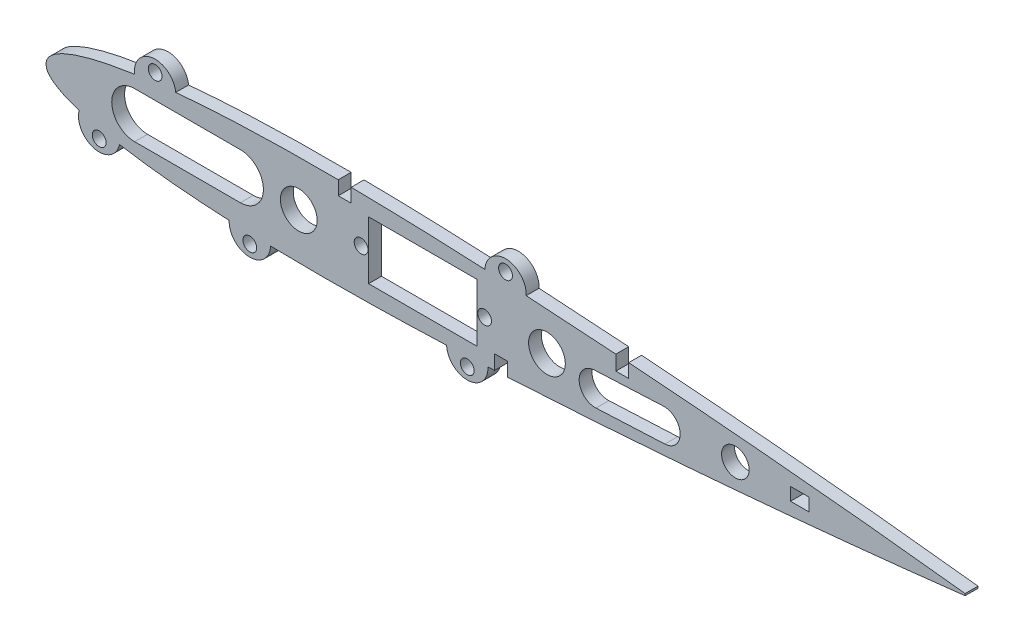
from build123d import *

# Parameters (mm, degrees)
SKETCH_3_R      = 4
SKETCH_3_R_2    = 3
SKETCH_3_R_3    = 1.5
SKETCH_3_R_4    = 1.500000004
SKETCH_3_R_5    = 1.499999999
SKETCH_3_W      = 23.6
SKETCH_3_H      = 12.6
SKETCH_3_W_2    = 4
SKETCH_3_H_2    = 2.8
EXTRUDE_3_DEPTH = 2.8


with BuildPart() as part:
    # Эскиз3 → Бобышка-Вытянуть3 (new body)
    with BuildSketch(Plane.XY):
        with BuildLine():
            Line((200, 0.21), (200, -0.21))
            add(Edge.make_bspline(
                [(173.839461144, -3.040801203), (175.943333039, -2.830170954), (179.564023078, -2.461029339), (184.58704572, -1.932479181), (188.771568451, -1.480695182), (192.530784687, -1.065063842), (195.747560944, -0.701689979), (198.179524953, -0.422303954), (199.520051416, -0.265971644), (200, -0.21)],
                knots=[0.870307302, 0.870307302, 0.870307302, 0.870307302, 0.901571134, 0.924121062, 0.944988816, 0.963803939, 0.980044339, 0.992855276, 1, 1, 1, 1], degree=3))
            Line((173.839461144, -3.040801203), (162.170244806, -4.170244806))
            add(Edge.make_bspline(
                [(100.4, -8.802264), (100.782530515, -8.78200637), (103.102887785, -8.657921344), (107.374551667, -8.416266925), (113.223109349, -8.057497647), (119.097620698, -7.671146294), (124.98256269, -7.259840679), (130.861479372, -6.826169971), (136.716836604, -6.372892076), (142.52985565, -5.902766003), (148.280267017, -5.418602057), (153.94609331, -4.923426646), (158.566687276, -4.50520567), (161.295968592, -4.251994411), (162.170244806, -4.170244806)],
                knots=[0.507199784, 0.507199784, 0.507199784, 0.507199784, 0.512863887, 0.541558094, 0.570462313, 0.599504248, 0.628607349, 0.657690446, 0.686667237, 0.715444849, 0.743923546, 0.77199483, 0.799540253, 0.812523886, 0.812523886, 0.812523886, 0.812523886], degree=3))
            Line((100.4, -8.802264), (100.4, -5.802264))
            Line((100.4, -5.802264), (97.6, -5.802264))
            Line((97.6, -5.802264), (97.6, -8.946938935))
            add(Edge.make_bspline(
                [(96.16294038, -9.018329177), (96.641976589, -8.994862294), (97.120996479, -8.971063118), (97.6, -8.946938935)],
                knots=[0.486289284, 0.486289284, 0.486289284, 0.486289284, 0.493380908, 0.493380908, 0.493380908, 0.493380908], degree=3))
            ThreePointArc((96.16294038, -9.018329177), (91.867526446, -13.724080291), (87.17182932, -9.417677743))
            add(Edge.make_bspline(
                [(48.849842288, -9.876307099), (50.29548458, -9.910701869), (53.368870018, -9.967597185), (58.119580476, -10.007674079), (63.1472323, -10.001179647), (68.312112853, -9.948180779), (73.603706203, -9.849984193), (79.011121779, -9.708185508), (83.546665754, -9.557168434), (86.278412172, -9.453068368), (87.17182932, -9.417677743)],
                knots=[0.253007448, 0.253007448, 0.253007448, 0.253007448, 0.274388983, 0.298458209, 0.323253842, 0.348727971, 0.374830387, 0.40150919, 0.428710016, 0.441930624, 0.441930624, 0.441930624, 0.441930624], degree=3))
            ThreePointArc((48.849842288, -9.876307099), (44.191437181, -14.24080929), (39.855729482, -9.55559251))
            add(Edge.make_bspline(
                [(15.984525285, -7.176038428), (16.462030484, -7.259158951), (17.98454817, -7.513637269), (20.631718929, -7.904294519), (23.999672572, -8.325205071), (27.586779878, -8.701741845), (31.384869898, -9.032475932), (35.385580654, -9.316092874), (38.232256125, -9.476007566), (39.743803487, -9.550160154), (39.855729482, -9.55559251)],
                knots=[0.090340762, 0.090340762, 0.090340762, 0.090340762, 0.097507218, 0.113164082, 0.12990269, 0.147690304, 0.166492185, 0.186271967, 0.206991861, 0.208648761, 0.208648761, 0.208648761, 0.208648761], degree=3))
            ThreePointArc((15.984525285, -7.176038428), (10.553276044, -10.683492951), (7.222061882, -5.142399398))
            add(Edge.make_bspline(
                [(0, 0), (0.032444913, -0.278495812), (0.100633198, -0.863800259), (0.62379252, -1.678905598), (1.407454519, -2.445359097), (2.482159911, -3.178007514), (3.831515726, -3.881540279), (5.438246861, -4.54900077), (6.605008441, -4.947778836), (7.222061882, -5.142399398)],
                knots=[0, 0, 0, 0, 0.004099011, 0.008614742, 0.013934855, 0.020277775, 0.027752981, 0.036410215, 0.045976094, 0.045976094, 0.045976094, 0.045976094], degree=3))
            add(Edge.make_bspline(
                [(19.284694791, 7.702161614), (18.661991317, 7.611303464), (17.067549655, 7.367338744), (14.58489291, 6.936612431), (11.921305119, 6.393879384), (9.507426038, 5.81478546), (7.350195056, 5.201638101), (5.45639967, 4.556541724), (3.831515725, 3.88154028), (2.48215991, 3.178007515), (1.407454518, 2.445359098), (0.62379252, 1.678905598), (0.100633198, 0.863800259), (0.032444913, 0.278495812), (0, 0)],
                knots=[0.893188074, 0.893188074, 0.893188074, 0.893188074, 0.902492782, 0.917037139, 0.930441054, 0.942679762, 0.953733567, 0.963589785, 0.972247019, 0.979722225, 0.986065145, 0.991385258, 0.995900989, 1, 1, 1, 1], degree=3))
            ThreePointArc((19.284694791, 7.702161614), (23.222530105, 12.753724018), (28.222638882, 8.75075738))
            add(Edge.make_bspline(
                [(63.6, 9.990751447), (63.433767139, 9.991846739), (61.590618822, 10.003190391), (58.119580476, 10.007674079), (53.23934089, 9.96650448), (48.51637403, 9.877065972), (43.960263435, 9.738807032), (39.580313293, 9.551735955), (35.385580654, 9.316092874), (31.619699098, 9.049123359), (29.254379223, 8.84661187), (28.222638882, 8.75075738)],
                knots=[0.674288155, 0.674288155, 0.674288155, 0.674288155, 0.676746158, 0.701541791, 0.725611017, 0.748907835, 0.771387785, 0.793008139, 0.813728033, 0.833507815, 0.84882888, 0.84882888, 0.84882888, 0.84882888], degree=3))
            Line((63.6, 9.990751447), (63.6, 6.965595937))
            Line((63.6, 6.965595937), (66.4, 6.965595937))
            Line((66.4, 6.965595937), (66.4, 9.965595937))
            add(Edge.make_bspline(
                [(95.498574643, 9.050660645), (93.699350388, 9.137637837), (90.030763168, 9.305301287), (84.52309051, 9.524657051), (79.011121778, 9.708185508), (73.603706202, 9.849984193), (69.41154014, 9.927778606), (67.023185068, 9.958531818), (66.4, 9.965595937)],
                knots=[0.516989075, 0.516989075, 0.516989075, 0.516989075, 0.543623846, 0.571289984, 0.59849081, 0.625169613, 0.651272029, 0.660487149, 0.660487149, 0.660487149, 0.660487149], degree=3))
            ThreePointArc((95.498574643, 9.050660645), (100.228464185, 13.308356698), (104.486160238, 8.578467155))
            add(Edge.make_bspline(
                [(124, 7.326294797), (122.364596134, 7.442700413), (118.769611386, 7.692718614), (113.223109349, 8.057497647), (108.353742435, 8.356200224), (105.444206381, 8.524292737), (104.486160238, 8.578467155)],
                knots=[0.376253135, 0.376253135, 0.376253135, 0.376253135, 0.400495752, 0.429537687, 0.458441906, 0.47263041, 0.47263041, 0.47263041, 0.47263041], degree=3))
            Line((124, 7.326294797), (124, 4.124412105))
            Line((124, 4.124412105), (126.8, 4.124412105))
            Line((126.8, 4.124412105), (126.8, 7.124412105))
            add(Edge.make_bspline(
                [(200, 0.21), (199.520051416, 0.265971644), (198.179524953, 0.422303954), (195.747560944, 0.701689979), (192.530784687, 1.065063842), (188.771568451, 1.480695182), (184.58704572, 1.932479181), (180.05616868, 2.409243063), (175.238405485, 2.90257428), (168.371896377, 3.585728287), (161.260104983, 4.261418012), (153.94609331, 4.923426646), (148.280267017, 5.418602057), (142.52985565, 5.902766003), (136.716836604, 6.372892076), (131.466708661, 6.779317653), (128.156255998, 7.025385403), (126.8, 7.124412105)],
                knots=[0, 0, 0, 0, 0.007144724, 0.019955661, 0.036196061, 0.055011184, 0.075878938, 0.098428866, 0.122375554, 0.147487885, 0.200459747, 0.22800517, 0.256076454, 0.284555151, 0.313332763, 0.342309554, 0.362416837, 0.362416837, 0.362416837, 0.362416837], degree=3))
        make_face()
        with Locations((109, 0)):
            Circle(SKETCH_3_R, mode=Mode.SUBTRACT)
        with Locations((55, 0)):
            Circle(SKETCH_3_R, mode=Mode.SUBTRACT)
        with Locations((150, 0)):
            Circle(SKETCH_3_R_2, mode=Mode.SUBTRACT)
        with Locations((68.565, 0)):
            Circle(SKETCH_3_R_3, mode=Mode.SUBTRACT)
        with Locations((95.435, 0)):
            Circle(SKETCH_3_R_3, mode=Mode.SUBTRACT)
        with Locations((23.746872016, 10.284376689)):
            Circle(SKETCH_3_R_4, mode=Mode.SUBTRACT)
        with Locations((11.570620364, -8.299999991)):
            Circle(SKETCH_3_R_5, mode=Mode.SUBTRACT)
        with Locations((44.351797521, -11.743667469)):
            Circle(SKETCH_3_R_5, mode=Mode.SUBTRACT)
        with Locations((91.667851618, -11.228512478)):
            Circle(SKETCH_3_R_3, mode=Mode.SUBTRACT)
        with Locations((99.99236744, 10.8145639)):
            Circle(SKETCH_3_R_3, mode=Mode.SUBTRACT)
        with BuildLine():
            Line((19.3, 5), (42.3, 5))
            ThreePointArc((42.3, 5), (47.3, 0), (42.3, -5))
            Line((42.3, -5), (19.3, -5))
            ThreePointArc((19.3, -5), (14.3, 0), (19.3, 5))
        make_face(mode=Mode.SUBTRACT)
        with BuildLine():
            Line((119.34345336, 1.992816182), (134.326801485, 2.699412943))
            ThreePointArc((134.326801485, 2.699412943), (137.987788625, -0.631829042), (134.65654664, -4.292816182))
            Line((134.65654664, -4.292816182), (119.673198515, -4.999412943))
            ThreePointArc((119.673198515, -4.999412943), (116.012211375, -1.668170958), (119.34345336, 1.992816182))
        make_face(mode=Mode.SUBTRACT)
        with Locations((82, 0)):
            Rectangle(SKETCH_3_W, SKETCH_3_H, mode=Mode.SUBTRACT)
        with Locations((164, 0)):
            Rectangle(SKETCH_3_W_2, SKETCH_3_H_2, mode=Mode.SUBTRACT)
    extrude(amount=EXTRUDE_3_DEPTH)


solid = part.part
